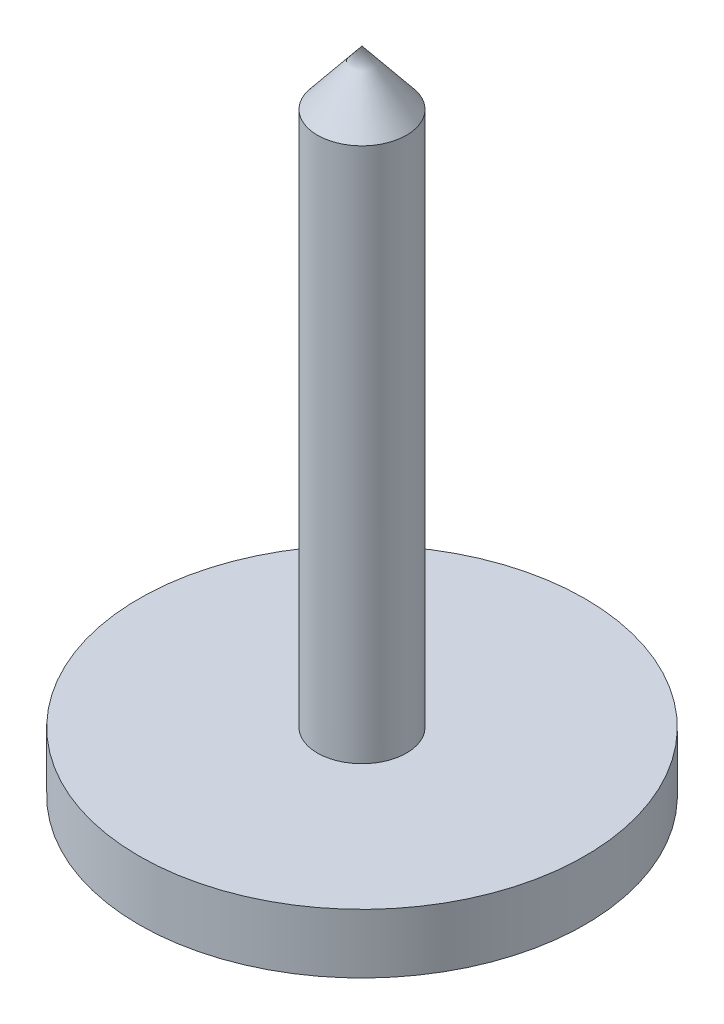
from build123d import *


with BuildPart() as part:
    # Sketch1 → Revolve1 (revolve)
    with BuildSketch(Plane.XY, mode=Mode.PRIVATE) as revolve1_sk:
        Polygon((0, 0), (37.5, 0), (37.5, 10), (7.5, 10), (7.5, 100), (0, 109.239571586), align=None)
    revolve(revolve1_sk.sketch.rotate(Axis((0, 109.239571586, 0), (0, -1, 0)), 90), axis=Axis((0, 109.239571586, 0), (0, -1, 0)))


solid = part.part
